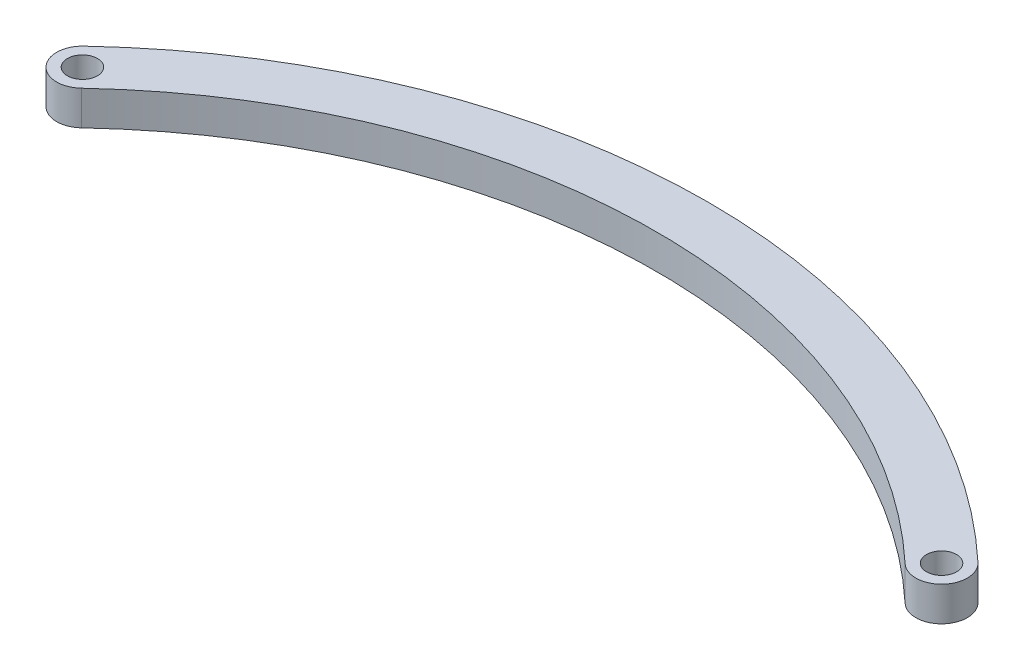
from build123d import *

# Parameters (mm, degrees)
ESQUISSE1_R        = 1.75
BOSS_EXTRU_1_DEPTH = 4


with BuildPart() as part:
    # Esquisse1 → Boss.-Extru.1 (new body)
    with BuildSketch(Plane(origin=(0, 0, 0), x_dir=(1, 0, 0), z_dir=(0, 1, 0))):
        with BuildLine():
            ThreePointArc((-52.054794536, 2.185822365), (-52.185822369, -2.054794533), (-47.945205471, -2.185822372))
            ThreePointArc((-47.945205471, -2.185822372), (-1.4e-08, 16.811655412), (47.94520545, -2.185822352))
            ThreePointArc((47.94520545, -2.185822352), (52.185822338, -2.054794566), (52.054794582, 2.185822323))
            ThreePointArc((52.054794582, 2.185822323), (3.1e-08, 22.811655412), (-52.054794536, 2.185822365))
        make_face()
        with Locations(Location((-50, 0, 0), (0, 0, 270))):
            Circle(ESQUISSE1_R, mode=Mode.SUBTRACT)
        with Locations(Location((50, 0, 0), (0, 0, 270))):
            Circle(ESQUISSE1_R, mode=Mode.SUBTRACT)
    extrude(amount=BOSS_EXTRU_1_DEPTH)


solid = part.part
